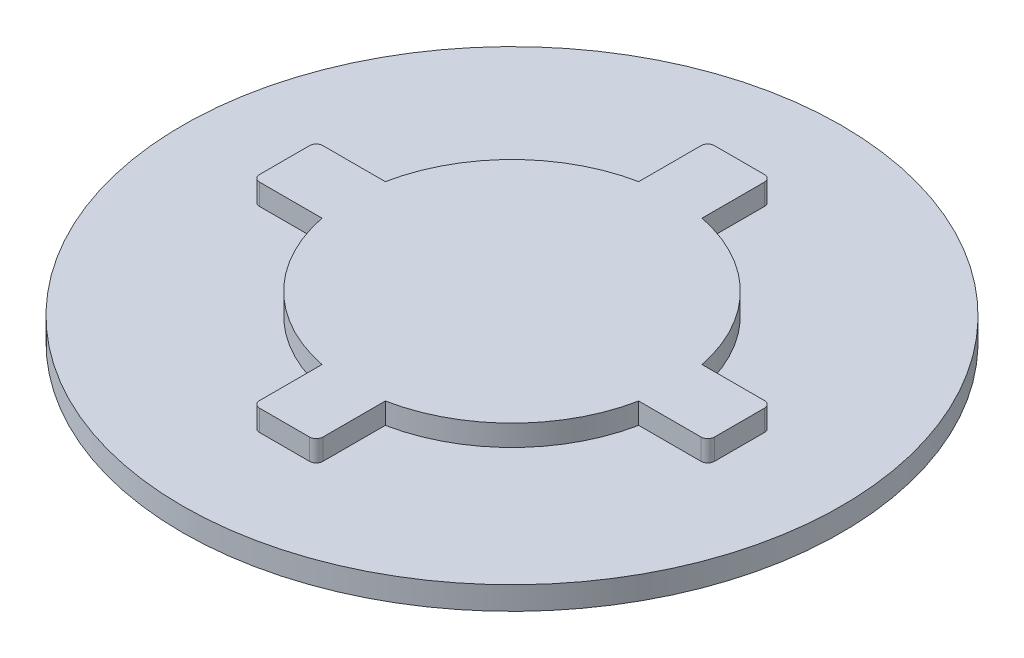
from build123d import *

# Parameters (mm, degrees)
CROQUIS5_R              = 24.5
SALIENTE_EXTRUIR3_DEPTH = 3.2
SALIENTE_EXTRUIR4_DEPTH = 3.2
CROQUIS7_R              = 50
SALIENTE_EXTRUIR5_DEPTH = 3.5
CROQUIS8_W              = 5
CROQUIS8_H              = 5
CORTAR_EXTRUIR3_DEPTH   = 2
CROQUIS9_R              = 3.535533906
CORTAR_EXTRUIR4_DEPTH   = 2.5


with BuildPart() as part:
    # Croquis5 → Saliente-Extruir3 (new body)
    with BuildSketch(Plane(origin=(0, 0, 0), x_dir=(1, 0, 0), z_dir=(0, 1, 0))):
        with Locations(Location((0, 0, 0), (0, 0, 270))):
            Circle(CROQUIS5_R)
    extrude(amount=SALIENTE_EXTRUIR3_DEPTH)

    # Croquis6 → Saliente-Extruir4 (add)
    with BuildSketch(Plane.XZ):
        with BuildLine():
            Line((33.5, 4.8), (-33.5, 4.8))
            ThreePointArc((-33.5, 4.8), (-34.207106781, 4.507106781), (-34.5, 3.8))
            Line((-34.5, 3.8), (-34.5, -3.8))
            ThreePointArc((-34.5, -3.8), (-34.207106781, -4.507106781), (-33.5, -4.8))
            Line((-33.5, -4.8), (33.5, -4.8))
            ThreePointArc((33.5, -4.8), (34.207106781, -4.507106781), (34.5, -3.8))
            Line((34.5, -3.8), (34.5, 3.8))
            ThreePointArc((34.5, 3.8), (34.207106781, 4.507106781), (33.5, 4.8))
        make_face()
        with BuildLine():
            Line((3.8, -34.5), (-3.8, -34.5))
            ThreePointArc((-3.8, -34.5), (-4.507106781, -34.207106781), (-4.8, -33.5))
            Line((-4.8, -33.5), (-4.8, 33.5))
            ThreePointArc((-4.8, 33.5), (-4.507106781, 34.207106781), (-3.8, 34.5))
            Line((-3.8, 34.5), (3.8, 34.5))
            ThreePointArc((3.8, 34.5), (4.507106781, 34.207106781), (4.8, 33.5))
            Line((4.8, 33.5), (4.8, -33.5))
            ThreePointArc((4.8, -33.5), (4.507106781, -34.207106781), (3.8, -34.5))
        make_face()
    extrude(amount=-SALIENTE_EXTRUIR4_DEPTH)

    # Croquis7 → Saliente-Extruir5 (add)
    with BuildSketch(Plane.XZ):
        with Locations(Location((0, 0, 0), (0, 0, 270))):
            Circle(CROQUIS7_R)
    extrude(amount=SALIENTE_EXTRUIR5_DEPTH)

    # Croquis8 → Cortar-Extruir3 (cut)
    with BuildSketch(Plane.XZ.offset(3.5)):
        with BuildLine():
            Line((-2.5, -25), (2.5, -25))
            Line((2.5, -25), (2.5, -19.843134833))
            ThreePointArc((2.5, -19.843134833), (0, -20), (-2.5, -19.843134833))
            Line((-2.5, -19.843134833), (-2.5, -25))
        make_face()
        with BuildLine():
            ThreePointArc((-2.5, -19.843134833), (0, -20), (2.5, -19.843134833))
            Line((2.5, -19.843134833), (2.5, -14.790199458))
            ThreePointArc((2.5, -14.790199458), (0, -15), (-2.5, -14.790199458))
            Line((-2.5, -14.790199458), (-2.5, -19.843134833))
        make_face()
        with BuildLine():
            ThreePointArc((2.5, 19.843134833), (0, 20), (-2.5, 19.843134833))
            Line((-2.5, 19.843134833), (-2.5, 14.790199458))
            ThreePointArc((-2.5, 14.790199458), (0, 15), (2.5, 14.790199458))
            Line((2.5, 14.790199458), (2.5, 19.843134833))
        make_face()
        with BuildLine():
            ThreePointArc((-2.5, -14.790199458), (0, -15), (2.5, -14.790199458))
            Line((2.5, -14.790199458), (2.5, -2.5))
            Line((2.5, -2.5), (-2.5, -2.5))
            Line((-2.5, -2.5), (-2.5, -14.790199458))
        make_face()
        Rectangle(CROQUIS8_W, CROQUIS8_H)
        with BuildLine():
            Line((-2.5, 2.5), (2.5, 2.5))
            Line((2.5, 2.5), (2.5, 14.790199458))
            ThreePointArc((2.5, 14.790199458), (0, 15), (-2.5, 14.790199458))
            Line((-2.5, 14.790199458), (-2.5, 2.5))
        make_face()
        with BuildLine():
            Line((-2.5, 25), (-2.5, 19.843134833))
            ThreePointArc((-2.5, 19.843134833), (0, 20), (2.5, 19.843134833))
            Line((2.5, 19.843134833), (2.5, 25))
            Line((2.5, 25), (-2.5, 25))
        make_face()
        with BuildLine():
            Line((2.5, 2.5), (2.5, -2.5))
            Line((2.5, -2.5), (14.790199458, -2.5))
            ThreePointArc((14.790199458, -2.5), (14.947457842, -1.254393904), (15, 0))
            ThreePointArc((15, 0), (14.947457842, 1.254393904), (14.790199458, 2.5))
            Line((14.790199458, 2.5), (2.5, 2.5))
        make_face()
        with BuildLine():
            Line((14.790199458, -2.5), (19.843134833, -2.5))
            ThreePointArc((19.843134833, -2.5), (19.960745185, -1.252458251), (20, 0))
            ThreePointArc((20, 0), (19.960745185, 1.252458251), (19.843134833, 2.5))
            Line((19.843134833, 2.5), (14.790199458, 2.5))
            ThreePointArc((14.790199458, 2.5), (14.947457842, 1.254393904), (15, 0))
            ThreePointArc((15, 0), (14.947457842, -1.254393904), (14.790199458, -2.5))
        make_face()
        with BuildLine():
            ThreePointArc((-19.843134833, 2.5), (-20, 0), (-19.843134833, -2.5))
            Line((-19.843134833, -2.5), (-14.790199458, -2.5))
            ThreePointArc((-14.790199458, -2.5), (-15, 0), (-14.790199458, 2.5))
            Line((-14.790199458, 2.5), (-19.843134833, 2.5))
        make_face()
        with BuildLine():
            ThreePointArc((20, 0), (19.960745185, -1.252458251), (19.843134833, -2.5))
            Line((19.843134833, -2.5), (25, -2.5))
            Line((25, -2.5), (25, 2.5))
            Line((25, 2.5), (19.843134833, 2.5))
            ThreePointArc((19.843134833, 2.5), (19.960745185, 1.252458251), (20, 0))
        make_face()
        with BuildLine():
            Line((-14.790199458, -2.5), (-2.5, -2.5))
            Line((-2.5, -2.5), (-2.5, 2.5))
            Line((-2.5, 2.5), (-14.790199458, 2.5))
            ThreePointArc((-14.790199458, 2.5), (-15, 0), (-14.790199458, -2.5))
        make_face()
        with BuildLine():
            Line((-25, -2.5), (-19.843134833, -2.5))
            ThreePointArc((-19.843134833, -2.5), (-20, 0), (-19.843134833, 2.5))
            Line((-19.843134833, 2.5), (-25, 2.5))
            Line((-25, 2.5), (-25, -2.5))
        make_face()
        with BuildLine():
            ThreePointArc((-2.5, 19.843134833), (-14.142135624, 14.142135624), (-19.843134833, 2.5))
            Line((-19.843134833, 2.5), (-14.790199458, 2.5))
            ThreePointArc((-14.790199458, 2.5), (-10.606601718, 10.606601718), (-2.5, 14.790199458))
            Line((-2.5, 14.790199458), (-2.5, 19.843134833))
        make_face()
        with BuildLine():
            Line((14.790199458, 2.5), (19.843134833, 2.5))
            ThreePointArc((19.843134833, 2.5), (14.142135624, 14.142135624), (2.5, 19.843134833))
            Line((2.5, 19.843134833), (2.5, 14.790199458))
            ThreePointArc((2.5, 14.790199458), (10.606601718, 10.606601718), (14.790199458, 2.5))
        make_face()
        with BuildLine():
            Line((2.5, -14.790199458), (2.5, -19.843134833))
            ThreePointArc((2.5, -19.843134833), (14.142135624, -14.142135624), (19.843134833, -2.5))
            Line((19.843134833, -2.5), (14.790199458, -2.5))
            ThreePointArc((14.790199458, -2.5), (10.606601718, -10.606601718), (2.5, -14.790199458))
        make_face()
        with BuildLine():
            ThreePointArc((-19.843134833, -2.5), (-14.142135624, -14.142135624), (-2.5, -19.843134833))
            Line((-2.5, -19.843134833), (-2.5, -14.790199458))
            ThreePointArc((-2.5, -14.790199458), (-10.606601718, -10.606601718), (-14.790199458, -2.5))
            Line((-14.790199458, -2.5), (-19.843134833, -2.5))
        make_face()
    extrude(amount=-CORTAR_EXTRUIR3_DEPTH, mode=Mode.SUBTRACT)

    # Croquis9 → Cortar-Extruir4 (cut)
    with BuildSketch(Plane.XZ.offset(1.5)):
        with Locations(Location((0, 0, 0), (0, 0, 270))):
            Circle(CROQUIS9_R)
    extrude(amount=-CORTAR_EXTRUIR4_DEPTH, mode=Mode.SUBTRACT)


solid = part.part
